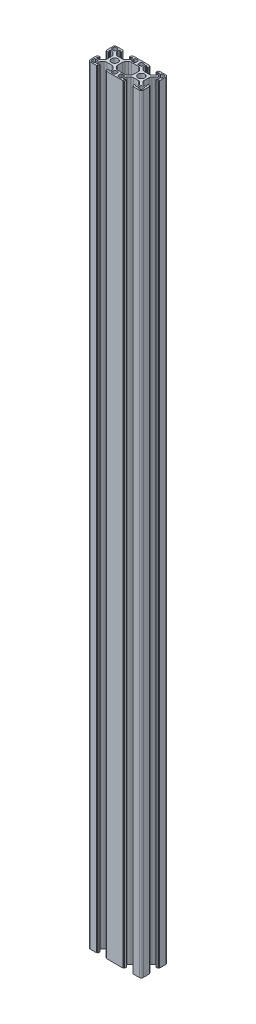
from build123d import *

# Parameters (mm, degrees)
EXTRUDE_1_DEPTH = 579


with BuildPart() as part:
    # Эскиз1 → Бобышка-Вытянуть1 (new body)
    with BuildSketch(Plane(origin=(0, 0, 0), x_dir=(1, 0, 0), z_dir=(0, 1, 0))):
        with BuildLine():
            Line((9.247825015, 4.683728486), (11.146605684, 4.683728486))
            ThreePointArc((11.146605684, 4.683728486), (11.911972549, 4.835969421), (12.560819246, 5.269514923))
            Line((12.560819246, 5.269514923), (13.862038577, 6.570734254))
            ThreePointArc((13.862038577, 6.570734254), (14.29558408, 7.219580952), (14.447825015, 7.984947817))
            Line((14.447825015, 7.984947817), (14.447825015, 8.883728486))
            ThreePointArc((14.447825015, 8.883728486), (14.301378405, 9.237281876), (13.947825015, 9.383728486))
            Line((13.947825015, 9.383728486), (13.844931796, 9.383728486))
            ThreePointArc((13.844931796, 9.383728486), (13.65359008, 9.345668252), (13.491378405, 9.237281876))
            Line((13.491378405, 9.237281876), (13.01104832, 8.75695179))
            ThreePointArc((13.01104832, 8.75695179), (12.929942482, 8.702758603), (12.834271624, 8.683728486))
            Line((12.834271624, 8.683728486), (12.547825015, 8.683728486))
            ThreePointArc((12.547825015, 8.683728486), (12.37104832, 8.75695179), (12.297825015, 8.933728486))
            Line((12.297825015, 8.933728486), (12.297825015, 10.082799306))
            ThreePointArc((12.297825015, 10.082799306), (12.341758998, 10.188865323), (12.447825015, 10.232799306))
            Line((12.447825015, 10.232799306), (12.947825015, 10.232799306))
            Line((12.947825015, 10.232799306), (12.947825015, 10.533728486))
            ThreePointArc((12.947825015, 10.533728486), (12.991758998, 10.639794503), (13.097825015, 10.683728486))
            Line((13.097825015, 10.683728486), (17.747825015, 10.683728486))
            ThreePointArc((17.747825015, 10.683728486), (18.808485187, 10.244388658), (19.247825015, 9.183728486))
            Line((19.247825015, 9.183728486), (19.247825015, 4.533728486))
            ThreePointArc((19.247825015, 4.533728486), (19.203891032, 4.427662469), (19.097825015, 4.383728486))
            Line((19.097825015, 4.383728486), (18.796895835, 4.383728486))
            Line((18.796895835, 4.383728486), (18.796895835, 3.883728486))
            ThreePointArc((18.796895835, 3.883728486), (18.752961853, 3.777662469), (18.646895835, 3.733728486))
            Line((18.646895835, 3.733728486), (17.497825015, 3.733728486))
            ThreePointArc((17.497825015, 3.733728486), (17.32104832, 3.80695179), (17.247825015, 3.983728486))
            Line((17.247825015, 3.983728486), (17.247825015, 4.270175095))
            ThreePointArc((17.247825015, 4.270175095), (17.266855132, 4.365845953), (17.32104832, 4.44695179))
            Line((17.32104832, 4.44695179), (17.801378405, 4.927281876))
            ThreePointArc((17.801378405, 4.927281876), (17.909764781, 5.089493551), (17.947825015, 5.280835267))
            Line((17.947825015, 5.280835267), (17.947825015, 5.383728486))
            ThreePointArc((17.947825015, 5.383728486), (17.801378405, 5.737281876), (17.447825015, 5.883728486))
            Line((17.447825015, 5.883728486), (16.549044346, 5.883728486))
            ThreePointArc((16.549044346, 5.883728486), (15.783677481, 5.731487551), (15.134830783, 5.297942048))
            Line((15.134830783, 5.297942048), (13.833611452, 3.996722717))
            ThreePointArc((13.833611452, 3.996722717), (13.40006595, 3.34787602), (13.247825015, 2.582509155))
            Line((13.247825015, 2.582509155), (13.247825015, 0.683728486))
            Line((13.247825015, 0.683728486), (13.247825015, -1.215052183))
            ThreePointArc((13.247825015, -1.215052183), (13.40006595, -1.980419048), (13.833611452, -2.629265746))
            Line((13.833611452, -2.629265746), (15.134830783, -3.930485077))
            ThreePointArc((15.134830783, -3.930485077), (15.783677481, -4.364030579), (16.549044346, -4.516271514))
            Line((16.549044346, -4.516271514), (17.447825015, -4.516271514))
            ThreePointArc((17.447825015, -4.516271514), (17.801378405, -4.369824905), (17.947825015, -4.016271514))
            Line((17.947825015, -4.016271514), (17.947825015, -3.913378295))
            ThreePointArc((17.947825015, -3.913378295), (17.909764781, -3.722036579), (17.801378405, -3.559824905))
            Line((17.801378405, -3.559824905), (17.32104832, -3.079494819))
            ThreePointArc((17.32104832, -3.079494819), (17.266855132, -2.998388982), (17.247825015, -2.902718124))
            Line((17.247825015, -2.902718124), (17.247825015, -2.616271514))
            ThreePointArc((17.247825015, -2.616271514), (17.32104832, -2.439494819), (17.497825015, -2.366271514))
            Line((17.497825015, -2.366271514), (18.646895835, -2.366271514))
            ThreePointArc((18.646895835, -2.366271514), (18.752961853, -2.410205497), (18.796895835, -2.516271514))
            Line((18.796895835, -2.516271514), (18.796895835, -3.016271514))
            Line((18.796895835, -3.016271514), (19.097825015, -3.016271514))
            ThreePointArc((19.097825015, -3.016271514), (19.203891032, -3.060205497), (19.247825015, -3.166271514))
            Line((19.247825015, -3.166271514), (19.247825015, -7.816271514))
            ThreePointArc((19.247825015, -7.816271514), (18.808485187, -8.876931686), (17.747825015, -9.316271514))
            Line((17.747825015, -9.316271514), (13.097825015, -9.316271514))
            ThreePointArc((13.097825015, -9.316271514), (12.991758998, -9.272337531), (12.947825015, -9.166271514))
            Line((12.947825015, -9.166271514), (12.947825015, -8.865342335))
            Line((12.947825015, -8.865342335), (12.447825015, -8.865342335))
            ThreePointArc((12.447825015, -8.865342335), (12.341758998, -8.821408352), (12.297825015, -8.715342335))
            Line((12.297825015, -8.715342335), (12.297825015, -7.566271514))
            ThreePointArc((12.297825015, -7.566271514), (12.37104832, -7.389494819), (12.547825015, -7.316271514))
            Line((12.547825015, -7.316271514), (12.834271624, -7.316271514))
            ThreePointArc((12.834271624, -7.316271514), (12.929942482, -7.335301631), (13.01104832, -7.389494819))
            Line((13.01104832, -7.389494819), (13.491378405, -7.869824905))
            ThreePointArc((13.491378405, -7.869824905), (13.65359008, -7.978211281), (13.844931796, -8.016271514))
            Line((13.844931796, -8.016271514), (13.947825015, -8.016271514))
            ThreePointArc((13.947825015, -8.016271514), (14.301378405, -7.869824905), (14.447825015, -7.516271514))
            Line((14.447825015, -7.516271514), (14.447825015, -6.617490845))
            ThreePointArc((14.447825015, -6.617490845), (14.29558408, -5.85212398), (13.862038577, -5.203277283))
            Line((13.862038577, -5.203277283), (12.560819246, -3.902057952))
            ThreePointArc((12.560819246, -3.902057952), (11.911972549, -3.468512449), (11.146605684, -3.316271514))
            Line((11.146605684, -3.316271514), (9.247825015, -3.316271514))
            Line((9.247825015, -3.316271514), (7.349044346, -3.316271514))
            ThreePointArc((7.349044346, -3.316271514), (6.583677481, -3.468512449), (5.934830783, -3.902057952))
            Line((5.934830783, -3.902057952), (4.633611452, -5.203277283))
            ThreePointArc((4.633611452, -5.203277283), (4.20006595, -5.85212398), (4.047825015, -6.617490845))
            Line((4.047825015, -6.617490845), (4.047825015, -7.516271514))
            ThreePointArc((4.047825015, -7.516271514), (4.194271624, -7.869824905), (4.547825015, -8.016271514))
            Line((4.547825015, -8.016271514), (4.650718234, -8.016271514))
            ThreePointArc((4.650718234, -8.016271514), (4.84205995, -7.978211281), (5.004271624, -7.869824905))
            Line((5.004271624, -7.869824905), (5.48460171, -7.389494819))
            ThreePointArc((5.48460171, -7.389494819), (5.565707547, -7.335301631), (5.661378405, -7.316271514))
            Line((5.661378405, -7.316271514), (5.947825015, -7.316271514))
            ThreePointArc((5.947825015, -7.316271514), (6.12460171, -7.389494819), (6.197825015, -7.566271514))
            Line((6.197825015, -7.566271514), (6.197825015, -8.715342335))
            ThreePointArc((6.197825015, -8.715342335), (6.153891032, -8.821408352), (6.047825015, -8.865342335))
            Line((6.047825015, -8.865342335), (5.547825015, -8.865342335))
            Line((5.547825015, -8.865342335), (5.547825015, -9.166271514))
            ThreePointArc((5.547825015, -9.166271514), (5.503891032, -9.272337531), (5.397825015, -9.316271514))
            Line((5.397825015, -9.316271514), (0.747825015, -9.316271514))
            Line((0.747825015, -9.316271514), (-2.252174985, -9.316271514))
            Line((-2.252174985, -9.316271514), (-6.902174985, -9.316271514))
            ThreePointArc((-6.902174985, -9.316271514), (-7.008241002, -9.272337531), (-7.052174985, -9.166271514))
            Line((-7.052174985, -9.166271514), (-7.052174985, -8.865342335))
            Line((-7.052174985, -8.865342335), (-7.552174985, -8.865342335))
            ThreePointArc((-7.552174985, -8.865342335), (-7.658241002, -8.821408352), (-7.702174985, -8.715342335))
            Line((-7.702174985, -8.715342335), (-7.702174985, -7.566271514))
            ThreePointArc((-7.702174985, -7.566271514), (-7.62895168, -7.389494819), (-7.452174985, -7.316271514))
            Line((-7.452174985, -7.316271514), (-7.165728376, -7.316271514))
            ThreePointArc((-7.165728376, -7.316271514), (-7.070057518, -7.335301631), (-6.98895168, -7.389494819))
            Line((-6.98895168, -7.389494819), (-6.508621595, -7.869824905))
            ThreePointArc((-6.508621595, -7.869824905), (-6.34640992, -7.978211281), (-6.155068204, -8.016271514))
            Line((-6.155068204, -8.016271514), (-6.052174985, -8.016271514))
            ThreePointArc((-6.052174985, -8.016271514), (-5.698621595, -7.869824905), (-5.552174985, -7.516271514))
            Line((-5.552174985, -7.516271514), (-5.552174985, -6.617490845))
            ThreePointArc((-5.552174985, -6.617490845), (-5.70441592, -5.85212398), (-6.137961423, -5.203277283))
            Line((-6.137961423, -5.203277283), (-7.439180754, -3.902057952))
            ThreePointArc((-7.439180754, -3.902057952), (-8.088027451, -3.468512449), (-8.853394316, -3.316271514))
            Line((-8.853394316, -3.316271514), (-10.752174985, -3.316271514))
            Line((-10.752174985, -3.316271514), (-12.650955654, -3.316271514))
            ThreePointArc((-12.650955654, -3.316271514), (-13.416322519, -3.468512449), (-14.065169217, -3.902057952))
            Line((-14.065169217, -3.902057952), (-15.366388548, -5.203277283))
            ThreePointArc((-15.366388548, -5.203277283), (-15.79993405, -5.85212398), (-15.952174985, -6.617490845))
            Line((-15.952174985, -6.617490845), (-15.952174985, -7.516271514))
            ThreePointArc((-15.952174985, -7.516271514), (-15.805728376, -7.869824905), (-15.452174985, -8.016271514))
            Line((-15.452174985, -8.016271514), (-15.349281766, -8.016271514))
            ThreePointArc((-15.349281766, -8.016271514), (-15.15794005, -7.978211281), (-14.995728376, -7.869824905))
            Line((-14.995728376, -7.869824905), (-14.51539829, -7.389494819))
            ThreePointArc((-14.51539829, -7.389494819), (-14.434292453, -7.335301631), (-14.338621595, -7.316271514))
            Line((-14.338621595, -7.316271514), (-14.052174985, -7.316271514))
            ThreePointArc((-14.052174985, -7.316271514), (-13.87539829, -7.389494819), (-13.802174985, -7.566271514))
            Line((-13.802174985, -7.566271514), (-13.802174985, -8.715342335))
            ThreePointArc((-13.802174985, -8.715342335), (-13.846108968, -8.821408352), (-13.952174985, -8.865342335))
            Line((-13.952174985, -8.865342335), (-14.452174985, -8.865342335))
            Line((-14.452174985, -8.865342335), (-14.452174985, -9.166271514))
            ThreePointArc((-14.452174985, -9.166271514), (-14.496108968, -9.272337531), (-14.602174985, -9.316271514))
            Line((-14.602174985, -9.316271514), (-19.252174985, -9.316271514))
            ThreePointArc((-19.252174985, -9.316271514), (-20.312835157, -8.876931686), (-20.752174985, -7.816271514))
            Line((-20.752174985, -7.816271514), (-20.752174985, -3.166271514))
            ThreePointArc((-20.752174985, -3.166271514), (-20.708241002, -3.060205497), (-20.602174985, -3.016271514))
            Line((-20.602174985, -3.016271514), (-20.301245806, -3.016271514))
            Line((-20.301245806, -3.016271514), (-20.301245806, -2.516271514))
            ThreePointArc((-20.301245806, -2.516271514), (-20.257311823, -2.410205497), (-20.151245806, -2.366271514))
            Line((-20.151245806, -2.366271514), (-19.002174985, -2.366271514))
            ThreePointArc((-19.002174985, -2.366271514), (-18.82539829, -2.439494819), (-18.752174985, -2.616271514))
            Line((-18.752174985, -2.616271514), (-18.752174985, -2.902718124))
            ThreePointArc((-18.752174985, -2.902718124), (-18.771205102, -2.998388982), (-18.82539829, -3.079494819))
            Line((-18.82539829, -3.079494819), (-19.305728376, -3.559824905))
            ThreePointArc((-19.305728376, -3.559824905), (-19.414114751, -3.722036579), (-19.452174985, -3.913378295))
            Line((-19.452174985, -3.913378295), (-19.452174985, -4.016271514))
            ThreePointArc((-19.452174985, -4.016271514), (-19.305728376, -4.369824905), (-18.952174985, -4.516271514))
            Line((-18.952174985, -4.516271514), (-18.053394316, -4.516271514))
            ThreePointArc((-18.053394316, -4.516271514), (-17.288027451, -4.364030579), (-16.639180754, -3.930485077))
            Line((-16.639180754, -3.930485077), (-15.337961423, -2.629265746))
            ThreePointArc((-15.337961423, -2.629265746), (-14.90441592, -1.980419048), (-14.752174985, -1.215052183))
            Line((-14.752174985, -1.215052183), (-14.752174985, 0.683728486))
            Line((-14.752174985, 0.683728486), (-14.752174985, 2.582509155))
            ThreePointArc((-14.752174985, 2.582509155), (-14.90441592, 3.34787602), (-15.337961423, 3.996722717))
            Line((-15.337961423, 3.996722717), (-16.639180754, 5.297942048))
            ThreePointArc((-16.639180754, 5.297942048), (-17.288027451, 5.731487551), (-18.053394316, 5.883728486))
            Line((-18.053394316, 5.883728486), (-18.952174985, 5.883728486))
            ThreePointArc((-18.952174985, 5.883728486), (-19.305728376, 5.737281876), (-19.452174985, 5.383728486))
            Line((-19.452174985, 5.383728486), (-19.452174985, 5.280835267))
            ThreePointArc((-19.452174985, 5.280835267), (-19.414114751, 5.089493551), (-19.305728376, 4.927281876))
            Line((-19.305728376, 4.927281876), (-18.82539829, 4.44695179))
            ThreePointArc((-18.82539829, 4.44695179), (-18.771205102, 4.365845953), (-18.752174985, 4.270175095))
            Line((-18.752174985, 4.270175095), (-18.752174985, 3.983728486))
            ThreePointArc((-18.752174985, 3.983728486), (-18.82539829, 3.80695179), (-19.002174985, 3.733728486))
            Line((-19.002174985, 3.733728486), (-20.151245806, 3.733728486))
            ThreePointArc((-20.151245806, 3.733728486), (-20.257311823, 3.777662469), (-20.301245806, 3.883728486))
            Line((-20.301245806, 3.883728486), (-20.301245806, 4.383728486))
            Line((-20.301245806, 4.383728486), (-20.602174985, 4.383728486))
            ThreePointArc((-20.602174985, 4.383728486), (-20.708241002, 4.427662469), (-20.752174985, 4.533728486))
            Line((-20.752174985, 4.533728486), (-20.752174985, 9.183728486))
            ThreePointArc((-20.752174985, 9.183728486), (-20.312835157, 10.244388658), (-19.252174985, 10.683728486))
            Line((-19.252174985, 10.683728486), (-14.602174985, 10.683728486))
            ThreePointArc((-14.602174985, 10.683728486), (-14.496108968, 10.639794503), (-14.452174985, 10.533728486))
            Line((-14.452174985, 10.533728486), (-14.452174985, 10.232799306))
            Line((-14.452174985, 10.232799306), (-13.952174985, 10.232799306))
            ThreePointArc((-13.952174985, 10.232799306), (-13.846108968, 10.188865323), (-13.802174985, 10.082799306))
            Line((-13.802174985, 10.082799306), (-13.802174985, 8.933728486))
            ThreePointArc((-13.802174985, 8.933728486), (-13.87539829, 8.75695179), (-14.052174985, 8.683728486))
            Line((-14.052174985, 8.683728486), (-14.338621595, 8.683728486))
            ThreePointArc((-14.338621595, 8.683728486), (-14.434292453, 8.702758603), (-14.51539829, 8.75695179))
            Line((-14.51539829, 8.75695179), (-14.995728376, 9.237281876))
            ThreePointArc((-14.995728376, 9.237281876), (-15.15794005, 9.345668252), (-15.349281766, 9.383728486))
            Line((-15.349281766, 9.383728486), (-15.452174985, 9.383728486))
            ThreePointArc((-15.452174985, 9.383728486), (-15.805728376, 9.237281876), (-15.952174985, 8.883728486))
            Line((-15.952174985, 8.883728486), (-15.952174985, 7.984947817))
            ThreePointArc((-15.952174985, 7.984947817), (-15.79993405, 7.219580952), (-15.366388548, 6.570734254))
            Line((-15.366388548, 6.570734254), (-14.065169217, 5.269514923))
            ThreePointArc((-14.065169217, 5.269514923), (-13.416322519, 4.835969421), (-12.650955654, 4.683728486))
            Line((-12.650955654, 4.683728486), (-10.752174985, 4.683728486))
            Line((-10.752174985, 4.683728486), (-8.853394316, 4.683728486))
            ThreePointArc((-8.853394316, 4.683728486), (-8.088027451, 4.835969421), (-7.439180754, 5.269514923))
            Line((-7.439180754, 5.269514923), (-6.137961423, 6.570734254))
            ThreePointArc((-6.137961423, 6.570734254), (-5.70441592, 7.219580952), (-5.552174985, 7.984947817))
            Line((-5.552174985, 7.984947817), (-5.552174985, 8.883728486))
            ThreePointArc((-5.552174985, 8.883728486), (-5.698621595, 9.237281876), (-6.052174985, 9.383728486))
            Line((-6.052174985, 9.383728486), (-6.155068204, 9.383728486))
            ThreePointArc((-6.155068204, 9.383728486), (-6.34640992, 9.345668252), (-6.508621595, 9.237281876))
            Line((-6.508621595, 9.237281876), (-6.98895168, 8.75695179))
            ThreePointArc((-6.98895168, 8.75695179), (-7.070057518, 8.702758603), (-7.165728376, 8.683728486))
            Line((-7.165728376, 8.683728486), (-7.452174985, 8.683728486))
            ThreePointArc((-7.452174985, 8.683728486), (-7.62895168, 8.75695179), (-7.702174985, 8.933728486))
            Line((-7.702174985, 8.933728486), (-7.702174985, 10.082799306))
            ThreePointArc((-7.702174985, 10.082799306), (-7.658241002, 10.188865323), (-7.552174985, 10.232799306))
            Line((-7.552174985, 10.232799306), (-7.052174985, 10.232799306))
            Line((-7.052174985, 10.232799306), (-7.052174985, 10.533728486))
            ThreePointArc((-7.052174985, 10.533728486), (-7.008241002, 10.639794503), (-6.902174985, 10.683728486))
            Line((-6.902174985, 10.683728486), (-2.252174985, 10.683728486))
            Line((-2.252174985, 10.683728486), (0.747825015, 10.683728486))
            Line((0.747825015, 10.683728486), (5.397825015, 10.683728486))
            ThreePointArc((5.397825015, 10.683728486), (5.503891032, 10.639794503), (5.547825015, 10.533728486))
            Line((5.547825015, 10.533728486), (5.547825015, 10.232799306))
            Line((5.547825015, 10.232799306), (6.047825015, 10.232799306))
            ThreePointArc((6.047825015, 10.232799306), (6.153891032, 10.188865323), (6.197825015, 10.082799306))
            Line((6.197825015, 10.082799306), (6.197825015, 8.933728486))
            ThreePointArc((6.197825015, 8.933728486), (6.12460171, 8.75695179), (5.947825015, 8.683728486))
            Line((5.947825015, 8.683728486), (5.661378405, 8.683728486))
            ThreePointArc((5.661378405, 8.683728486), (5.565707547, 8.702758603), (5.48460171, 8.75695179))
            Line((5.48460171, 8.75695179), (5.004271624, 9.237281876))
            ThreePointArc((5.004271624, 9.237281876), (4.84205995, 9.345668252), (4.650718234, 9.383728486))
            Line((4.650718234, 9.383728486), (4.547825015, 9.383728486))
            ThreePointArc((4.547825015, 9.383728486), (4.194271624, 9.237281876), (4.047825015, 8.883728486))
            Line((4.047825015, 8.883728486), (4.047825015, 7.984947817))
            ThreePointArc((4.047825015, 7.984947817), (4.20006595, 7.219580952), (4.633611452, 6.570734254))
            Line((4.633611452, 6.570734254), (5.934830783, 5.269514923))
            ThreePointArc((5.934830783, 5.269514923), (6.583677481, 4.835969421), (7.349044346, 4.683728486))
            Line((7.349044346, 4.683728486), (9.247825015, 4.683728486))
        make_face()
        with BuildLine():
            Line((16.147825015, 6.783728486), (17.547825015, 6.783728486))
            ThreePointArc((17.547825015, 6.783728486), (18.11351044, 7.018043061), (18.347825015, 7.583728486))
            Line((18.347825015, 7.583728486), (18.347825015, 8.983728486))
            ThreePointArc((18.347825015, 8.983728486), (18.11351044, 9.549413911), (17.547825015, 9.783728486))
            Line((17.547825015, 9.783728486), (16.147825015, 9.783728486))
            ThreePointArc((16.147825015, 9.783728486), (15.58213959, 9.549413911), (15.347825015, 8.983728486))
            Line((15.347825015, 8.983728486), (15.347825015, 7.583728486))
            ThreePointArc((15.347825015, 7.583728486), (15.58213959, 7.018043061), (16.147825015, 6.783728486))
        make_face(mode=Mode.SUBTRACT)
        with BuildLine():
            Line((15.347825015, -6.216271514), (15.347825015, -7.616271514))
            ThreePointArc((15.347825015, -7.616271514), (15.58213959, -8.181956939), (16.147825015, -8.416271514))
            Line((16.147825015, -8.416271514), (17.547825015, -8.416271514))
            ThreePointArc((17.547825015, -8.416271514), (18.11351044, -8.181956939), (18.347825015, -7.616271514))
            Line((18.347825015, -7.616271514), (18.347825015, -6.216271514))
            ThreePointArc((18.347825015, -6.216271514), (18.11351044, -5.650586089), (17.547825015, -5.416271514))
            Line((17.547825015, -5.416271514), (16.147825015, -5.416271514))
            ThreePointArc((16.147825015, -5.416271514), (15.58213959, -5.650586089), (15.347825015, -6.216271514))
        make_face(mode=Mode.SUBTRACT)
        with BuildLine():
            Line((2.347825015, -5.416271514), (0.947825015, -5.416271514))
            ThreePointArc((0.947825015, -5.416271514), (0.38213959, -5.650586089), (0.147825015, -6.216271514))
            Line((0.147825015, -6.216271514), (0.147825015, -7.616271514))
            ThreePointArc((0.147825015, -7.616271514), (0.38213959, -8.181956939), (0.947825015, -8.416271514))
            Line((0.947825015, -8.416271514), (2.347825015, -8.416271514))
            ThreePointArc((2.347825015, -8.416271514), (2.91351044, -8.181956939), (3.147825015, -7.616271514))
            Line((3.147825015, -7.616271514), (3.147825015, -6.216271514))
            ThreePointArc((3.147825015, -6.216271514), (2.91351044, -5.650586089), (2.347825015, -5.416271514))
        make_face(mode=Mode.SUBTRACT)
        with BuildLine():
            Line((1.047825015, -4.516271514), (1.946605684, -4.516271514))
            ThreePointArc((1.946605684, -4.516271514), (2.711972549, -4.364030579), (3.360819246, -3.930485077))
            Line((3.360819246, -3.930485077), (4.662038577, -2.629265746))
            ThreePointArc((4.662038577, -2.629265746), (5.09558408, -1.980419048), (5.247825015, -1.215052183))
            Line((5.247825015, -1.215052183), (5.247825015, 0.683728486))
            Line((5.247825015, 0.683728486), (5.247825015, 2.582509155))
            ThreePointArc((5.247825015, 2.582509155), (5.09558408, 3.34787602), (4.662038577, 3.996722717))
            Line((4.662038577, 3.996722717), (3.360819246, 5.297942048))
            ThreePointArc((3.360819246, 5.297942048), (2.711972549, 5.731487551), (1.946605684, 5.883728486))
            Line((1.946605684, 5.883728486), (1.047825015, 5.883728486))
            Line((1.047825015, 5.883728486), (-2.552174985, 5.883728486))
            Line((-2.552174985, 5.883728486), (-3.450955654, 5.883728486))
            ThreePointArc((-3.450955654, 5.883728486), (-4.216322519, 5.731487551), (-4.865169217, 5.297942048))
            Line((-4.865169217, 5.297942048), (-6.166388548, 3.996722717))
            ThreePointArc((-6.166388548, 3.996722717), (-6.59993405, 3.34787602), (-6.752174985, 2.582509155))
            Line((-6.752174985, 2.582509155), (-6.752174985, 0.683728486))
            Line((-6.752174985, 0.683728486), (-6.752174985, -1.215052183))
            ThreePointArc((-6.752174985, -1.215052183), (-6.59993405, -1.980419048), (-6.166388548, -2.629265746))
            Line((-6.166388548, -2.629265746), (-4.865169217, -3.930485077))
            ThreePointArc((-4.865169217, -3.930485077), (-4.216322519, -4.364030579), (-3.450955654, -4.516271514))
            Line((-3.450955654, -4.516271514), (-2.552174985, -4.516271514))
            Line((-2.552174985, -4.516271514), (1.047825015, -4.516271514))
        make_face(mode=Mode.SUBTRACT)
        with BuildLine():
            Line((3.147825015, 7.583728486), (3.147825015, 8.983728486))
            ThreePointArc((3.147825015, 8.983728486), (2.91351044, 9.549413911), (2.347825015, 9.783728486))
            Line((2.347825015, 9.783728486), (0.947825015, 9.783728486))
            ThreePointArc((0.947825015, 9.783728486), (0.38213959, 9.549413911), (0.147825015, 8.983728486))
            Line((0.147825015, 8.983728486), (0.147825015, 7.583728486))
            ThreePointArc((0.147825015, 7.583728486), (0.38213959, 7.018043061), (0.947825015, 6.783728486))
            Line((0.947825015, 6.783728486), (2.347825015, 6.783728486))
            ThreePointArc((2.347825015, 6.783728486), (2.91351044, 7.018043061), (3.147825015, 7.583728486))
        make_face(mode=Mode.SUBTRACT)
        with BuildLine():
            Line((-2.452174985, 9.783728486), (-3.852174985, 9.783728486))
            ThreePointArc((-3.852174985, 9.783728486), (-4.41786041, 9.549413911), (-4.652174985, 8.983728486))
            Line((-4.652174985, 8.983728486), (-4.652174985, 7.583728486))
            ThreePointArc((-4.652174985, 7.583728486), (-4.41786041, 7.018043061), (-3.852174985, 6.783728486))
            Line((-3.852174985, 6.783728486), (-2.452174985, 6.783728486))
            ThreePointArc((-2.452174985, 6.783728486), (-1.88648956, 7.018043061), (-1.652174985, 7.583728486))
            Line((-1.652174985, 7.583728486), (-1.652174985, 8.983728486))
            ThreePointArc((-1.652174985, 8.983728486), (-1.88648956, 9.549413911), (-2.452174985, 9.783728486))
        make_face(mode=Mode.SUBTRACT)
        with BuildLine():
            Line((-1.652174985, -7.616271514), (-1.652174985, -6.216271514))
            ThreePointArc((-1.652174985, -6.216271514), (-1.88648956, -5.650586089), (-2.452174985, -5.416271514))
            Line((-2.452174985, -5.416271514), (-3.852174985, -5.416271514))
            ThreePointArc((-3.852174985, -5.416271514), (-4.41786041, -5.650586089), (-4.652174985, -6.216271514))
            Line((-4.652174985, -6.216271514), (-4.652174985, -7.616271514))
            ThreePointArc((-4.652174985, -7.616271514), (-4.41786041, -8.181956939), (-3.852174985, -8.416271514))
            Line((-3.852174985, -8.416271514), (-2.452174985, -8.416271514))
            ThreePointArc((-2.452174985, -8.416271514), (-1.88648956, -8.181956939), (-1.652174985, -7.616271514))
        make_face(mode=Mode.SUBTRACT)
        with BuildLine():
            Line((-19.052174985, -8.416271514), (-17.652174985, -8.416271514))
            ThreePointArc((-17.652174985, -8.416271514), (-17.08648956, -8.181956939), (-16.852174985, -7.616271514))
            Line((-16.852174985, -7.616271514), (-16.852174985, -6.216271514))
            ThreePointArc((-16.852174985, -6.216271514), (-17.08648956, -5.650586089), (-17.652174985, -5.416271514))
            Line((-17.652174985, -5.416271514), (-19.052174985, -5.416271514))
            ThreePointArc((-19.052174985, -5.416271514), (-19.61786041, -5.650586089), (-19.852174985, -6.216271514))
            Line((-19.852174985, -6.216271514), (-19.852174985, -7.616271514))
            ThreePointArc((-19.852174985, -7.616271514), (-19.61786041, -8.181956939), (-19.052174985, -8.416271514))
        make_face(mode=Mode.SUBTRACT)
        with BuildLine():
            Line((-19.852174985, 8.983728486), (-19.852174985, 7.583728486))
            ThreePointArc((-19.852174985, 7.583728486), (-19.61786041, 7.018043061), (-19.052174985, 6.783728486))
            Line((-19.052174985, 6.783728486), (-17.652174985, 6.783728486))
            ThreePointArc((-17.652174985, 6.783728486), (-17.08648956, 7.018043061), (-16.852174985, 7.583728486))
            Line((-16.852174985, 7.583728486), (-16.852174985, 8.983728486))
            ThreePointArc((-16.852174985, 8.983728486), (-17.08648956, 9.549413911), (-17.652174985, 9.783728486))
            Line((-17.652174985, 9.783728486), (-19.052174985, 9.783728486))
            ThreePointArc((-19.052174985, 9.783728486), (-19.61786041, 9.549413911), (-19.852174985, 8.983728486))
        make_face(mode=Mode.SUBTRACT)
        with BuildLine():
            ThreePointArc((11.747825015, 0.683728486), (11.015591968, 2.451495439), (9.247825015, 3.183728486))
            ThreePointArc((9.247825015, 3.183728486), (7.480058062, 2.451495439), (6.747825015, 0.683728486))
            ThreePointArc((6.747825015, 0.683728486), (7.480058062, -1.084038467), (9.247825015, -1.816271514))
            ThreePointArc((9.247825015, -1.816271514), (11.015591968, -1.084038467), (11.747825015, 0.683728486))
        make_face(mode=Mode.SUBTRACT)
        with BuildLine():
            ThreePointArc((-10.752174985, 3.183728486), (-8.984408032, 2.451495439), (-8.252174985, 0.683728486))
            ThreePointArc((-8.252174985, 0.683728486), (-8.984408032, -1.084038467), (-10.752174985, -1.816271514))
            ThreePointArc((-10.752174985, -1.816271514), (-12.519941938, -1.084038467), (-13.252174985, 0.683728486))
            ThreePointArc((-13.252174985, 0.683728486), (-12.519941938, 2.451495439), (-10.752174985, 3.183728486))
        make_face(mode=Mode.SUBTRACT)
    extrude(amount=EXTRUDE_1_DEPTH)


solid = part.part
